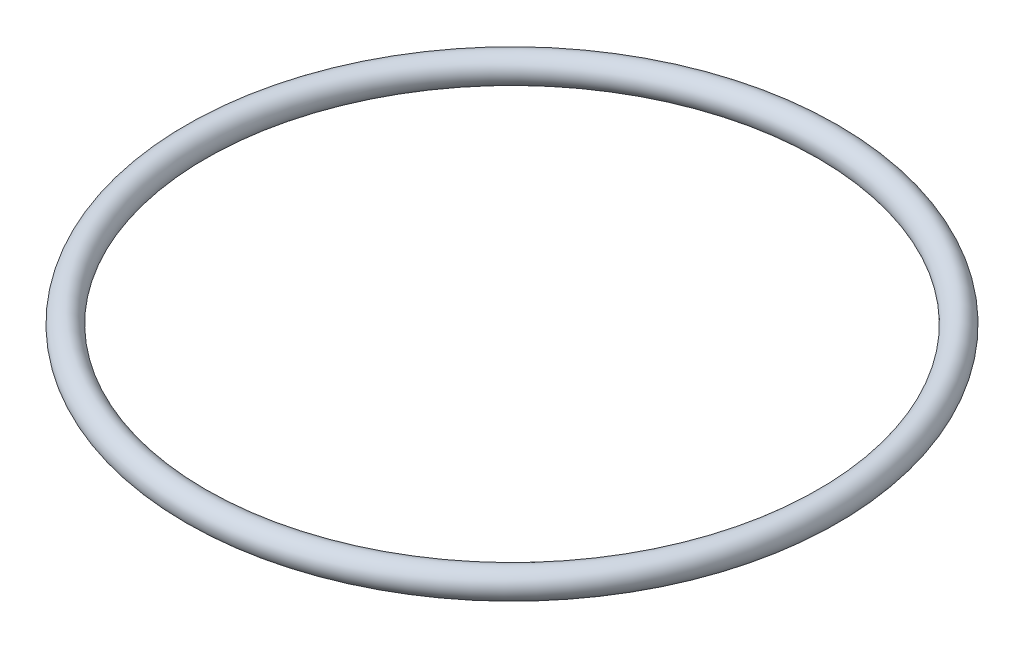
from build123d import *

# Parameters (mm, degrees)
SKETCH1_R = 0.79375


with BuildPart() as part:
    # Sketch1 → Revolve1 (revolve)
    with BuildSketch(Plane.XY, mode=Mode.PRIVATE) as revolve1_sk:
        with Locations((-18.30705, 0)):
            Circle(SKETCH1_R)
    revolve(revolve1_sk.sketch.rotate(Axis((0, 3.610450396, 0), (0, -1, 0)), 270), axis=Axis((0, 3.610450396, 0), (0, -1, 0)))


solid = part.part
